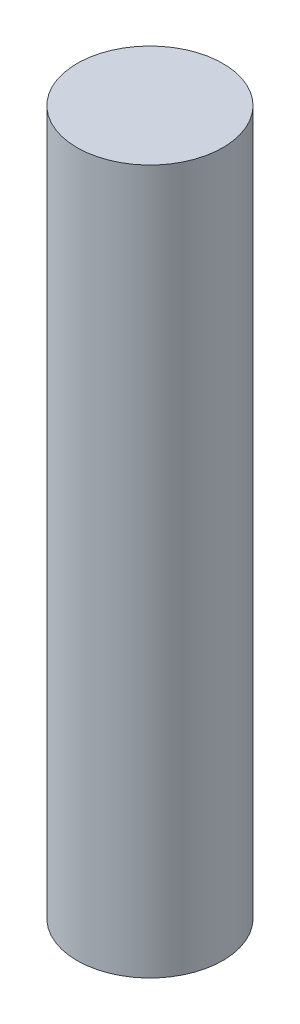
from build123d import *

# Parameters (mm, degrees)
SKETCH2_R           = 1.45
BOSS_EXTRUDE1_DEPTH = 14


with BuildPart() as part:
    # Sketch2 → Boss-Extrude1 (new body)
    with BuildSketch(Plane(origin=(0, 0, 0), x_dir=(1, 0, 0), z_dir=(0, 1, 0))):
        with Locations(Location((0, 0, 0), (0, 0, 270))):
            Circle(SKETCH2_R)
    extrude(amount=BOSS_EXTRUDE1_DEPTH)


solid = part.part
